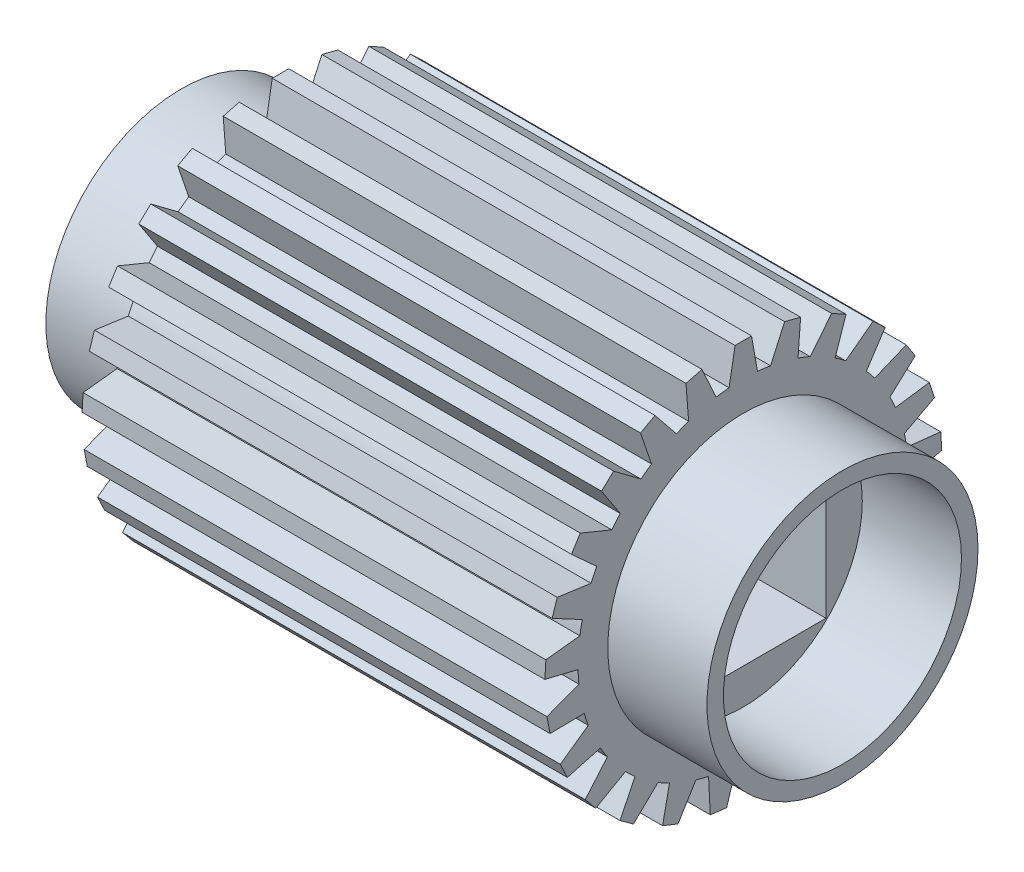
from build123d import *

# Parameters (mm, degrees)
BOSS_EXTRUDE2_START      = -9
BOSS_EXTRUDE2_DEPTH      = 14
BOSS_EXTRUDE3_DEPTH      = 5
BOSS_EXTRUDE3_DEPTH_BACK = 9
SKETCH3_R                = 5
CIRPATTERN1_COUNT        = 25
SKETCH4_W                = 5
SKETCH4_H                = 5
CUT_EXTRUDE1_DEPTH       = 18
BOSS_EXTRUDE4_DEPTH      = 3
BOSS_EXTRUDE4_DEPTH_BACK = 17
SKETCH6_R                = 4.1
SKETCH6_R_2              = 3.6
CUT_EXTRUDE2_DEPTH       = 10
CUT_EXTRUDE2_DEPTH_BACK  = 20
SKETCH7_W                = 5
SKETCH7_H                = 5.021637953


with BuildPart() as part:
    # Sketch2 → Boss-Extrude2 (new body)
    with BuildSketch(Plane(origin=(0, 0, 0), x_dir=(0, 0, -1), z_dir=(1, 0, 0)).offset(BOSS_EXTRUDE2_START)):
        with BuildLine():
            ThreePointArc((0.429587035, 4.981511315), (0, 5), (-0.429587035, 4.981511315))
            Line((-0.429587035, 4.981511315), (-0.700772987, 3.443539352))
            Line((-0.700772987, 3.443539352), (0.700772987, 3.443539352))
            Line((0.700772987, 3.443539352), (0.429587035, 4.981511315))
        make_face()
        with BuildLine():
            Line((0.25, 6), (-0.25, 6))
            Line((-0.25, 6), (-0.429587035, 4.981511315))
            ThreePointArc((-0.429587035, 4.981511315), (0, 5), (0.429587035, 4.981511315))
            Line((0.429587035, 4.981511315), (0.25, 6))
        make_face()
    boss_extrude2 = extrude(amount=BOSS_EXTRUDE2_DEPTH)

    # Sketch3 → Boss-Extrude3 (add, two sides: drawn at the far end of the back side and taken through both)
    with BuildSketch(Plane(origin=(0, 0, 0), x_dir=(0, 0, -1), z_dir=(1, 0, 0)).offset(-BOSS_EXTRUDE3_DEPTH_BACK)):
        Circle(SKETCH3_R)
    extrude(amount=BOSS_EXTRUDE3_DEPTH + BOSS_EXTRUDE3_DEPTH_BACK)

    # CirPattern1: Boss-Extrude2 ×25 about axis
    cirpattern1_axis = Axis((0, 0, 0), (1, 0, 0))
    for i in range(1, CIRPATTERN1_COUNT):
        add(boss_extrude2.rotate(cirpattern1_axis, i * 360 / CIRPATTERN1_COUNT))

    # Sketch4 → Cut-Extrude1 (cut)
    with BuildSketch(Plane(origin=(5, 0, 0), x_dir=(0, 0, -1), z_dir=(1, 0, 0))):
        Rectangle(SKETCH4_W, SKETCH4_H)
    extrude(amount=-CUT_EXTRUDE1_DEPTH, mode=Mode.SUBTRACT)

    # Sketch6 → Boss-Extrude4 (add, two sides: drawn at the far end of the back side and taken through both)
    with BuildSketch(Plane(origin=(5, 0, 0), x_dir=(0, 0, -1), z_dir=(1, 0, 0)).offset(-BOSS_EXTRUDE4_DEPTH_BACK)):
        Circle(SKETCH6_R)
        Circle(SKETCH6_R_2, mode=Mode.SUBTRACT)
    extrude(amount=BOSS_EXTRUDE4_DEPTH + BOSS_EXTRUDE4_DEPTH_BACK)

    # Sketch7 → Cut-Extrude2 (cut, two sides: drawn at the far end of the back side and taken through both)
    with BuildSketch(Plane(origin=(5, 0, 0), x_dir=(0, 0, -1), z_dir=(1, 0, 0)).offset(-CUT_EXTRUDE2_DEPTH_BACK)):
        with Locations((0, -0.010818977)):
            Rectangle(SKETCH7_W, SKETCH7_H)
    extrude(amount=CUT_EXTRUDE2_DEPTH + CUT_EXTRUDE2_DEPTH_BACK, mode=Mode.SUBTRACT)


solid = part.part
